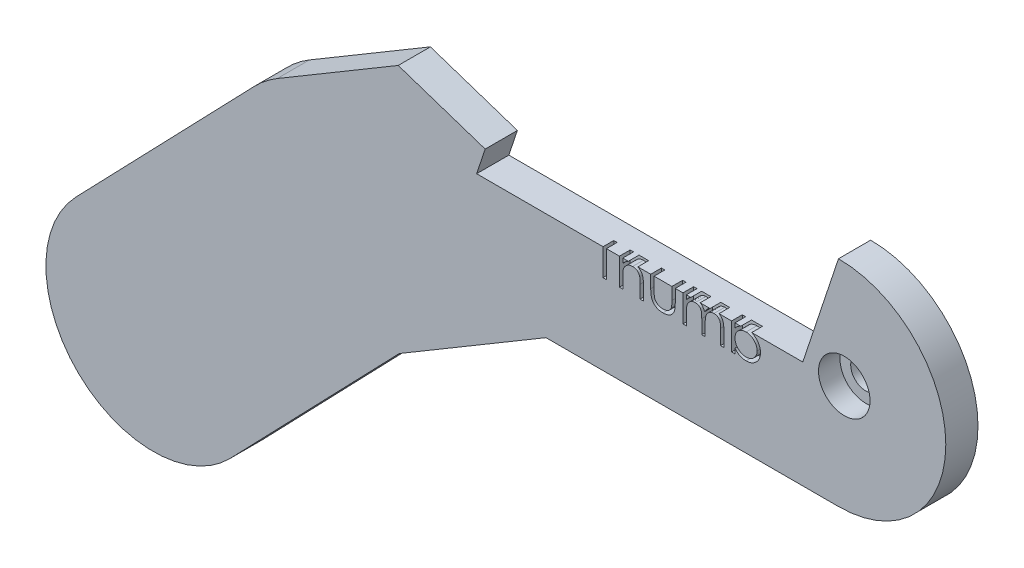
from build123d import *

# Parameters (mm, degrees)
BOSS_EXTRUDE1_DEPTH      = 3
BOSS_EXTRUDE2_DEPTH      = 3
BOSS_EXTRUDE4_DEPTH      = 3
SKETCH4_R                = 1.4
CUT_EXTRUDE5_DEPTH       = 3
SKETCH5_R                = 2.4
CUT_EXTRUDE6_DEPTH       = 2
CUT_EXTRUDE7_DEPTH       = 1
CUT_EXTRUDE12_DEPTH      = 58.771647766
CUT_EXTRUDE12_DEPTH_BACK = 58.771647766
CUT_EXTRUDE14_DEPTH      = 10


with BuildPart() as part:
    # Sketch1 → Boss-Extrude1 (new body)
    with BuildSketch(Plane.XY):
        with BuildLine():
            Line((0, 10), (30, 10))
            ThreePointArc((30, 10), (40, 0), (30, -10))
            Line((30, -10), (0, -10))
            ThreePointArc((0, -10), (-10, 0), (0, 10))
        make_face()
    extrude(amount=BOSS_EXTRUDE1_DEPTH)

    # Sketch2 → Boss-Extrude2 (add)
    with BuildSketch(Plane.XY):
        with BuildLine():
            Line((5.104260767, -8.599216361), (-12.094171954, -18.807737895))
            ThreePointArc((-12.094171954, -18.807737895), (-25.797649082, -15.312782302), (-22.302693489, -1.609305174))
            Line((-22.302693489, -1.609305174), (-5.104260767, 8.599216361))
            ThreePointArc((-5.104260767, 8.599216361), (8.599216361, 5.104260767), (5.104260767, -8.599216361))
        make_face()
    extrude(amount=BOSS_EXTRUDE2_DEPTH)

    # Sketch3 → Boss-Extrude4 (add)
    with BuildSketch(Plane.XY):
        with BuildLine():
            Line((-9.998884105, -17.148730445), (-26.65538549, -34.427647124))
            ThreePointArc((-26.65538549, -34.427647124), (-40.795143017, -34.68698683), (-41.054482723, -20.547229303))
            Line((-41.054482723, -20.547229303), (-24.397981338, -3.268312624))
            ThreePointArc((-24.397981338, -3.268312624), (-10.258223811, -3.008972918), (-9.998884105, -17.148730445))
        make_face()
    extrude(amount=BOSS_EXTRUDE4_DEPTH)

    # Sketch4 → Cut-Extrude5 (cut)
    with BuildSketch(Plane.XY):
        with Locations((30.538598823, 0)):
            Circle(SKETCH4_R)
    extrude(amount=CUT_EXTRUDE5_DEPTH, mode=Mode.SUBTRACT)

    # Sketch5 → Cut-Extrude6 (cut)
    with BuildSketch(Plane.XY.offset(3)):
        with Locations((30.538598823, 0)):
            Circle(SKETCH5_R)
    extrude(amount=-CUT_EXTRUDE6_DEPTH, mode=Mode.SUBTRACT)

    # Sketch6 → Cut-Extrude7 (cut)
    # profile 1 of 5: a face of its own
    with BuildSketch(Plane.XY.offset(3)):
        Polygon((7.297191398, 0.636947758), (7.297191398, 0.995922117), (9.136934988, 0.995922117), (9.136934988, 0.636947758), (8.374114475, 0.636947758), (8.374114475, -2.504077883), (8.060011911, -2.504077883), (8.060011911, 0.636947758), align=None)
    # profile 2 of 5: a face of its own
    with BuildSketch(Plane.XY.offset(3)):
        with BuildLine():
            Line((9.585652937, 1.085665707), (9.899755501, 1.085665707))
            Line((9.899755501, 1.085665707), (9.899755501, -0.429458492))
            add(Edge.make_bspline(
                [(9.899755501, -0.429458492), (9.933472803, -0.38731451), (9.999122117, -0.305258017), (10.109618233, -0.198196826), (10.223089105, -0.105398205), (10.343453915, -0.031527748), (10.468504436, 0.026828795), (10.59876808, 0.068216442), (10.734269051, 0.093667538), (10.826294201, 0.096865956), (10.872912552, 0.098486219)],
                knots=[0, 0, 0, 0, 1.125788106, 2.19196713, 3.20547328, 4.180437432, 5.132270164, 6.079753143, 7.027236121, 8, 8, 8, 8], degree=3))
            add(Edge.make_bspline(
                [(10.872912552, 0.098486219), (10.920242945, 0.096740789), (11.012879941, 0.093324561), (11.147761403, 0.06631118), (11.273722278, 0.020153742), (11.390388121, -0.043013283), (11.495212818, -0.12168611), (11.588062582, -0.212517633), (11.663903381, -0.317791551), (11.715502498, -0.415047805), (11.749075906, -0.501586559), (11.770327732, -0.575823071), (11.788346931, -0.658544984), (11.804046666, -0.749709717), (11.814510248, -0.849754888), (11.822914866, -0.958229143), (11.82889132, -1.075126261), (11.829122925, -1.15604651), (11.82924268, -1.197887979)],
                knots=[0, 0, 0, 0, 1.235656852, 2.418478516, 3.575258207, 4.727955599, 5.870717718, 6.98870536, 8.107142894, 9.245821548, 9.854588956, 10.528768408, 11.260415777, 12.065282286, 12.943670737, 13.886611085, 14.907229059, 16, 16, 16, 16], degree=3))
            Line((11.82924268, -1.197887979), (11.82924268, -2.504077883))
            Line((11.82924268, -2.504077883), (11.515140116, -2.504077883))
            Line((11.515140116, -2.504077883), (11.515140116, -1.300952883))
            add(Edge.make_bspline(
                [(11.515140116, -1.300952883), (11.514949813, -1.266130214), (11.514585796, -1.199520373), (11.513382451, -1.104154265), (11.510696236, -1.01765813), (11.50635541, -0.940309178), (11.501790103, -0.871999575), (11.495506785, -0.812828521), (11.488196551, -0.762714745), (11.48162777, -0.732550117), (11.478681783, -0.719021793)],
                knots=[0, 0, 0, 0, 1.430932559, 2.737130458, 3.918967929, 4.986496826, 5.920444988, 6.731744033, 7.431208747, 8, 8, 8, 8], degree=3))
            add(Edge.make_bspline(
                [(11.478681783, -0.719021793), (11.467257538, -0.67932753), (11.445294493, -0.603015539), (11.394246516, -0.499353129), (11.330487505, -0.410968388), (11.252640243, -0.3390541), (11.162081879, -0.282642561), (11.058221915, -0.243574779), (10.942037847, -0.219327057), (10.860186375, -0.216887753), (10.81752393, -0.215616345)],
                knots=[0, 0, 0, 0, 1.090059168, 2.095632401, 3.037101401, 3.955032261, 4.878929692, 5.839099886, 6.873700383, 8, 8, 8, 8], degree=3))
            add(Edge.make_bspline(
                [(10.81752393, -0.215616345), (10.792256157, -0.216092171), (10.742251887, -0.217033819), (10.668103221, -0.226487718), (10.596174158, -0.241936436), (10.52577198, -0.262840975), (10.458388782, -0.291286511), (10.392060457, -0.324216701), (10.328666248, -0.364524956), (10.267080431, -0.409750723), (10.209762898, -0.459820483), (10.156435783, -0.512667438), (10.108897442, -0.568942402), (10.065828851, -0.627742518), (10.028650566, -0.689874312), (9.996197484, -0.75473863), (9.968661787, -0.822420776), (9.954979095, -0.869395837), (9.948132905, -0.892899999)],
                knots=[0, 0, 0, 0, 1.024319606, 2.027102035, 3.025350316, 4.005802111, 5.00026367, 5.987881639, 7.005602596, 8.042517216, 9.083927026, 10.089214625, 11.084353441, 12.06828073, 13.041928858, 14.016821737, 15.00770877, 16, 16, 16, 16], degree=3))
            add(Edge.make_bspline(
                [(9.948132905, -0.892899999), (9.944193478, -0.909920949), (9.935608981, -0.947011696), (9.926294147, -1.00818602), (9.917956351, -1.079272392), (9.910907801, -1.160162993), (9.906584715, -1.251154235), (9.901926474, -1.351625194), (9.90019246, -1.462205215), (9.899905507, -1.539100722), (9.899755501, -1.579298236)],
                knots=[0, 0, 0, 0, 0.607992626, 1.324890765, 2.152360218, 3.099583803, 4.150613268, 5.323148443, 6.60066238, 8, 8, 8, 8], degree=3))
            Line((9.899755501, -1.579298236), (9.899755501, -2.504077883))
            Line((9.899755501, -2.504077883), (9.585652937, -2.504077883))
            Line((9.585652937, -2.504077883), (9.585652937, 1.085665707))
        make_face()
    # profile 3 of 5: a face of its own
    with BuildSketch(Plane.XY.offset(3)):
        with BuildLine():
            Line((12.502319604, 0.053614425), (12.816422168, 0.053614425))
            Line((12.816422168, 0.053614425), (12.816422168, -1.132683652))
            add(Edge.make_bspline(
                [(12.816422168, -1.132683652), (12.816564073, -1.167506402), (12.81683553, -1.23412069), (12.818676471, -1.329975876), (12.823006565, -1.417392589), (12.828420389, -1.496421326), (12.835382525, -1.567048717), (12.843665886, -1.629028074), (12.852924307, -1.683062258), (12.861987021, -1.715605614), (12.866201815, -1.730740543)],
                knots=[0, 0, 0, 0, 1.388932606, 2.656963016, 3.823490214, 4.879454478, 5.816252168, 6.653371382, 7.373723809, 8, 8, 8, 8], degree=3))
            add(Edge.make_bspline(
                [(12.866201815, -1.730740543), (12.87296327, -1.749763414), (12.886345611, -1.787413675), (12.910619095, -1.841802681), (12.940647431, -1.892177963), (12.973507259, -1.940482036), (13.011406667, -1.985284023), (13.053866138, -2.026508266), (13.099464375, -2.065712358), (13.167219398, -2.11209715), (13.259878664, -2.16181248), (13.38153142, -2.204708298), (13.513435646, -2.230344118), (13.604600365, -2.233318373), (13.651458225, -2.234847114)],
                knots=[0, 0, 0, 0, 0.725840625, 1.436591201, 2.137033971, 2.831655856, 3.53531722, 4.242432219, 4.957935707, 5.694543706, 7.190802206, 8.724350549, 10.316345118, 12, 12, 12, 12], degree=3))
            add(Edge.make_bspline(
                [(13.651458225, -2.234847114), (13.698311733, -2.233285865), (13.788964601, -2.230265138), (13.919419571, -2.2054816), (14.038670985, -2.16407591), (14.145521936, -2.106268499), (14.239487777, -2.035526436), (14.317792195, -1.952517627), (14.38239945, -1.85986824), (14.41060887, -1.790743961), (14.424795565, -1.755980928)],
                knots=[0, 0, 0, 0, 1.157059328, 2.238695713, 3.266970494, 4.264342957, 5.228770407, 6.160125903, 7.074715775, 8, 8, 8, 8], degree=3))
            add(Edge.make_bspline(
                [(14.424795565, -1.755980928), (14.428989795, -1.742014629), (14.438262213, -1.711138554), (14.448224565, -1.658758806), (14.457199027, -1.596294201), (14.464862203, -1.523335992), (14.470327365, -1.44007484), (14.473273392, -1.346536764), (14.476601667, -1.243015404), (14.476652183, -1.170547644), (14.476678578, -1.132683652)],
                knots=[0, 0, 0, 0, 0.557542046, 1.232589297, 2.036731608, 2.971723315, 4.038036528, 5.22795436, 6.551621927, 8, 8, 8, 8], degree=3))
            Line((14.476678578, -1.132683652), (14.476678578, 0.053614425))
            Line((14.476678578, 0.053614425), (14.790781142, 0.053614425))
            Line((14.790781142, 0.053614425), (14.790781142, -1.191577883))
            add(Edge.make_bspline(
                [(14.790781142, -1.191577883), (14.790339447, -1.233885055), (14.789482499, -1.315966754), (14.783975155, -1.435250866), (14.774525543, -1.546413111), (14.760182858, -1.649512331), (14.743317183, -1.744469812), (14.72156091, -1.831407258), (14.695582672, -1.910056812), (14.666277157, -1.981798589), (14.63165529, -2.046845483), (14.594828269, -2.1085813), (14.552303498, -2.165474235), (14.507533263, -2.220356372), (14.457731607, -2.2704979), (14.403831748, -2.317049376), (14.346592329, -2.360722407), (14.284743131, -2.399813687), (14.219187068, -2.435030332), (14.149843211, -2.46624641), (14.075862212, -2.490948987), (13.998198575, -2.512259653), (13.916471796, -2.528974122), (13.830760663, -2.540760689), (13.741094047, -2.54798602), (13.679984587, -2.548623065), (13.648653738, -2.548949678)],
                knots=[0, 0, 0, 0, 1.493040784, 2.896703357, 4.213163133, 5.428574705, 6.569057535, 7.615249723, 8.588095153, 9.490268104, 10.346124644, 11.18633936, 12.024365274, 12.850166724, 13.684164916, 14.514361689, 15.362232829, 16.222528818, 17.093394965, 17.986930858, 18.902426812, 19.842810585, 20.827885679, 21.843828298, 22.894529745, 24, 24, 24, 24], degree=3))
            add(Edge.make_bspline(
                [(13.648653738, -2.548949678), (13.617557224, -2.548609971), (13.556449679, -2.547942415), (13.466778435, -2.540800607), (13.380829828, -2.528992436), (13.29890943, -2.512137219), (13.220935033, -2.491098149), (13.146590793, -2.466094614), (13.07674723, -2.435014132), (13.010565226, -2.400036574), (12.948562838, -2.360471299), (12.890454259, -2.317103259), (12.836317407, -2.269997196), (12.786140339, -2.219349839), (12.740627362, -2.164532903), (12.699211321, -2.105987342), (12.661254615, -2.044293254), (12.626901825, -1.978230091), (12.59739007, -1.905658082), (12.571334824, -1.825360984), (12.550024185, -1.736458468), (12.532681717, -1.639026539), (12.518730276, -1.533531498), (12.509044134, -1.419363082), (12.503628303, -1.29679939), (12.502765242, -1.2121495), (12.502319604, -1.168440864)],
                knots=[0, 0, 0, 0, 1.083640291, 2.129454052, 3.13281866, 4.105697902, 5.042300162, 5.946461698, 6.836384745, 7.703652036, 8.553297018, 9.397182691, 10.228592656, 11.052265423, 11.879314572, 12.708807002, 13.549817954, 14.402308542, 15.300838682, 16.27712199, 17.341985831, 18.484375296, 19.725102775, 21.0496083, 22.476576903, 24, 24, 24, 24], degree=3))
            Line((12.502319604, -1.168440864), (12.502319604, 0.053614425))
        make_face()
    # profile 4 of 5: a face of its own
    with BuildSketch(Plane.XY.offset(3)):
        with BuildLine():
            Line((15.50872986, 0.053614425), (15.822832424, 0.053614425))
            Line((15.822832424, 0.053614425), (15.822832424, -0.390896793))
            add(Edge.make_bspline(
                [(15.822832424, -0.390896793), (15.851116374, -0.352009192), (15.905311134, -0.277496819), (15.994176786, -0.179306534), (16.082952899, -0.09597838), (16.14688628, -0.052235508), (16.177600052, -0.031221313)],
                knots=[0, 0, 0, 0, 1.134379233, 2.173579362, 3.122582517, 4, 4, 4, 4], degree=3))
            add(Edge.make_bspline(
                [(16.177600052, -0.031221313), (16.219464714, -0.011215947), (16.302462614, 0.028445266), (16.433881839, 0.068678825), (16.568356509, 0.093403926), (16.659164723, 0.0967853), (16.704843642, 0.098486219)],
                knots=[0, 0, 0, 0, 1.014936303, 2.012140481, 3.000054389, 4, 4, 4, 4], degree=3))
            add(Edge.make_bspline(
                [(16.704843642, 0.098486219), (16.735736639, 0.097440929), (16.796872218, 0.095372354), (16.887456308, 0.081912319), (16.97531492, 0.058646146), (17.059928949, 0.026238822), (17.139649628, -0.013007865), (17.212738826, -0.059057573), (17.278363034, -0.110754648), (17.336489085, -0.170433581), (17.388758111, -0.239770179), (17.436836957, -0.320634428), (17.48126217, -0.414842089), (17.505883479, -0.48320863), (17.518846046, -0.519202082)],
                knots=[0, 0, 0, 0, 1.009824226, 1.998387844, 2.986035974, 3.974953746, 4.955485308, 5.885931332, 6.793869504, 7.679848016, 8.601185859, 9.625726857, 10.749998409, 12, 12, 12, 12], degree=3))
            add(Edge.make_bspline(
                [(17.518846046, -0.519202082), (17.532557297, -0.494477663), (17.559539114, -0.445823478), (17.604844751, -0.376965215), (17.652312548, -0.312558424), (17.702347041, -0.252551999), (17.754771628, -0.197242269), (17.809833028, -0.146446367), (17.86721781, -0.099946153), (17.947010049, -0.045622994), (18.050822657, 0.012078187), (18.181710772, 0.062106631), (18.317860943, 0.09302276), (18.410278641, 0.096653033), (18.456947007, 0.098486219)],
                knots=[0, 0, 0, 0, 0.86119277, 1.694706429, 2.50939023, 3.298075842, 4.073795165, 4.829715201, 5.57930267, 6.321991688, 7.768977793, 9.186738141, 10.579381044, 12, 12, 12, 12], degree=3))
            add(Edge.make_bspline(
                [(18.456947007, 0.098486219), (18.49982847, 0.096868999), (18.583751656, 0.09370394), (18.705928922, 0.068850467), (18.819870728, 0.02617282), (18.925347804, -0.032060817), (19.020507617, -0.10524), (19.103223926, -0.192308838), (19.17299429, -0.292651461), (19.218572929, -0.387043449), (19.249488193, -0.470378782), (19.268549428, -0.541385073), (19.285389123, -0.619536626), (19.299370368, -0.704926888), (19.30958892, -0.797857496), (19.317159636, -0.898176372), (19.322283709, -1.005961484), (19.322645782, -1.080326984), (19.322832424, -1.118661216)],
                knots=[0, 0, 0, 0, 1.209669288, 2.367440248, 3.500751976, 4.631527125, 5.755587489, 6.87532382, 8.007944318, 9.190864318, 9.82315674, 10.514484317, 11.263564316, 12.079023757, 12.955305781, 13.901327259, 14.918167583, 16, 16, 16, 16], degree=3))
            Line((19.322832424, -1.118661216), (19.322832424, -2.504077883))
            Line((19.322832424, -2.504077883), (19.00872986, -2.504077883))
            Line((19.00872986, -2.504077883), (19.00872986, -1.117258973))
            add(Edge.make_bspline(
                [(19.00872986, -1.117258973), (19.008651977, -1.084538399), (19.008502298, -1.021654432), (19.005808666, -0.931401981), (19.000733352, -0.849133624), (18.994798713, -0.774961535), (18.986554904, -0.708712747), (18.975908972, -0.650520328), (18.964631292, -0.599926517), (18.945895301, -0.543840469), (18.91594741, -0.481970259), (18.87032993, -0.415246683), (18.812859823, -0.357165883), (18.746499667, -0.306747566), (18.670951222, -0.265753925), (18.587686499, -0.236477915), (18.497222447, -0.218355037), (18.434599659, -0.216549021), (18.402259507, -0.215616345)],
                knots=[0, 0, 0, 0, 1.253487763, 2.409012846, 3.458416907, 4.410876679, 5.259312806, 6.014470957, 6.676830364, 7.243083969, 8.276244668, 9.299465089, 10.325150304, 11.392391894, 12.482080715, 13.603491619, 14.762376348, 16, 16, 16, 16], degree=3))
            add(Edge.make_bspline(
                [(18.402259507, -0.215616345), (18.362589553, -0.217032502), (18.284186642, -0.219831367), (18.169741156, -0.24840524), (18.059770139, -0.291485491), (17.957555006, -0.353917948), (17.863527215, -0.428726312), (17.782627638, -0.517675908), (17.715795452, -0.618305835), (17.670541476, -0.711452537), (17.641952175, -0.795121981), (17.623075259, -0.868219353), (17.608391868, -0.951300921), (17.594621338, -1.043808412), (17.58563361, -1.146378592), (17.577465238, -1.258536993), (17.573644375, -1.380620952), (17.573109917, -1.465247641), (17.572832424, -1.509186056)],
                knots=[0, 0, 0, 0, 1.090531906, 2.155305635, 3.229839962, 4.33261226, 5.44038871, 6.529323825, 7.629011124, 8.757537029, 9.370236727, 10.061839251, 10.834451254, 11.692844982, 12.636905849, 13.66920014, 14.789842145, 16, 16, 16, 16], degree=3))
            Line((17.572832424, -1.509186056), (17.572832424, -2.504077883))
            Line((17.572832424, -2.504077883), (17.25872986, -2.504077883))
            Line((17.25872986, -2.504077883), (17.25872986, -1.203496954))
            add(Edge.make_bspline(
                [(17.25872986, -1.203496954), (17.258650429, -1.166803635), (17.258497612, -1.096209378), (17.255821294, -0.994975702), (17.250734673, -0.902894622), (17.244854124, -0.820073158), (17.236393946, -0.74666183), (17.226784184, -0.682267072), (17.215435573, -0.627050321), (17.196645689, -0.566486936), (17.16793122, -0.499766013), (17.121742958, -0.428624992), (17.064135378, -0.366356894), (16.996564502, -0.313198146), (16.92055882, -0.269256664), (16.836575419, -0.237596913), (16.745370506, -0.219172623), (16.6824928, -0.216824126), (16.650156142, -0.215616345)],
                knots=[0, 0, 0, 0, 1.320475261, 2.540461679, 3.643808994, 4.639130445, 5.527981419, 6.302341397, 6.981980563, 7.553956391, 8.582137848, 9.585246428, 10.591171744, 11.620968678, 12.668337649, 13.738356861, 14.836885341, 16, 16, 16, 16], degree=3))
            add(Edge.make_bspline(
                [(16.650156142, -0.215616345), (16.612139931, -0.217146805), (16.536374971, -0.220196957), (16.425073001, -0.247651231), (16.317587318, -0.290655306), (16.215632619, -0.350315125), (16.121958471, -0.424214203), (16.039950203, -0.511129099), (15.971007678, -0.609978133), (15.925275863, -0.702142649), (15.895777389, -0.783715924), (15.876182054, -0.853066872), (15.859342428, -0.93006712), (15.846828407, -1.014954231), (15.834747991, -1.107175325), (15.828917682, -1.207189815), (15.82324612, -1.314911903), (15.822973705, -1.389284448), (15.822832424, -1.427855928)],
                knots=[0, 0, 0, 0, 1.098833095, 2.189935336, 3.297829714, 4.440610912, 5.596351641, 6.740013378, 7.886572111, 9.072425424, 9.705826452, 10.395263256, 11.156850408, 11.985370555, 12.878090359, 13.847760091, 14.883794034, 16, 16, 16, 16], degree=3))
            Line((15.822832424, -1.427855928), (15.822832424, -2.504077883))
            Line((15.822832424, -2.504077883), (15.50872986, -2.504077883))
            Line((15.50872986, -2.504077883), (15.50872986, 0.053614425))
        make_face()
    # profile 5 of 5: a face of its own
    with BuildSketch(Plane.XY.offset(3)):
        with BuildLine():
            Line((20.040781142, -2.504077883), (20.040781142, 1.085665707))
            Line((20.040781142, 1.085665707), (20.354883706, 1.085665707))
            Line((20.354883706, 1.085665707), (20.354883706, -0.410528204))
            add(Edge.make_bspline(
                [(20.354883706, -0.410528204), (20.390277125, -0.369770272), (20.459331145, -0.290249867), (20.575107596, -0.186402217), (20.696513165, -0.098349739), (20.824471421, -0.025763621), (20.959164354, 0.029509986), (21.099896463, 0.069932376), (21.247027504, 0.094319279), (21.347346678, 0.097085352), (21.398152937, 0.098486219)],
                knots=[0, 0, 0, 0, 1.077089805, 2.101446609, 3.097517232, 4.067117542, 5.031729543, 5.997785507, 6.985986182, 8, 8, 8, 8], degree=3))
            add(Edge.make_bspline(
                [(21.398152937, 0.098486219), (21.443319075, 0.097245991), (21.532620227, 0.094793849), (21.663902374, 0.076159353), (21.790215649, 0.045941551), (21.911491297, 0.004049372), (22.027163429, -0.051533605), (22.138222486, -0.118074913), (22.244099471, -0.197313242), (22.343154356, -0.287911553), (22.434448243, -0.386268176), (22.514360753, -0.491448491), (22.581860449, -0.601923581), (22.637691741, -0.717323644), (22.680862794, -0.838119995), (22.710605062, -0.964194193), (22.729498526, -1.095422212), (22.731878772, -1.184735016), (22.733088834, -1.230139582)],
                knots=[0, 0, 0, 0, 1.034377878, 2.045141349, 3.03070803, 4.00595497, 4.978199603, 5.965204761, 6.967410914, 8.002051993, 9.036360596, 10.037508045, 11.022711142, 11.997267194, 12.969246472, 13.954813154, 14.960274251, 16, 16, 16, 16], degree=3))
            add(Edge.make_bspline(
                [(22.733088834, -1.230139582), (22.731852394, -1.2748396), (22.729414328, -1.362980995), (22.71079302, -1.492687551), (22.680046755, -1.61752625), (22.636085572, -1.737174508), (22.580820633, -1.852194421), (22.511709357, -1.961274825), (22.431898358, -2.066313801), (22.339567209, -2.163937432), (22.239653656, -2.254170832), (22.132739414, -2.332576697), (22.021517492, -2.400293817), (21.90425438, -2.453949265), (21.782686338, -2.497350186), (21.655510951, -2.527467877), (21.523447723, -2.545040932), (21.433728835, -2.547636499), (21.388337232, -2.548949678)],
                knots=[0, 0, 0, 0, 1.024244038, 2.01964794, 2.996620209, 3.965911562, 4.936179293, 5.91563013, 6.920572822, 7.955171681, 8.990768464, 10.002129126, 10.989675881, 11.969873457, 12.952483066, 13.943799762, 14.959703725, 16, 16, 16, 16], degree=3))
            add(Edge.make_bspline(
                [(21.388337232, -2.548949678), (21.336372119, -2.54750907), (21.234477595, -2.544684288), (21.08542493, -2.521265309), (20.94434338, -2.481403699), (20.809625832, -2.427841943), (20.683198109, -2.355313289), (20.564257527, -2.265356539), (20.453554154, -2.156489402), (20.388337339, -2.073427912), (20.354883706, -2.030820672)],
                knots=[0, 0, 0, 0, 1.035807596, 2.031038093, 2.998900396, 3.954262848, 4.914341711, 5.895762244, 6.92060972, 8, 8, 8, 8], degree=3))
            Line((20.354883706, -2.030820672), (20.354883706, -2.504077883))
            Line((20.354883706, -2.504077883), (20.040781142, -2.504077883))
        make_face()
        with BuildLine():
            add(Edge.make_bspline(
                [(21.385532745, -2.234847114), (21.431447097, -2.233213485), (21.522074726, -2.229988961), (21.655118516, -2.204815338), (21.782432726, -2.162931224), (21.903375808, -2.105647516), (22.01605512, -2.033625481), (22.116707754, -1.946479311), (22.206187464, -1.846977796), (22.28083924, -1.734744103), (22.343165484, -1.615293134), (22.38597876, -1.489638832), (22.414698482, -1.361144043), (22.41755078, -1.273997999), (22.41898627, -1.230139582)],
                knots=[0, 0, 0, 0, 1.031910345, 2.036826888, 3.032245421, 4.038315463, 5.03827337, 6.029480047, 7.023177075, 8.037597977, 9.052889626, 10.043399556, 11.015292101, 12, 12, 12, 12], degree=3))
            add(Edge.make_bspline(
                [(22.41898627, -1.230139582), (22.417098526, -1.18632404), (22.413330575, -1.098867879), (22.386955792, -0.969218212), (22.340898002, -0.843630587), (22.279779979, -0.722452599), (22.203911994, -0.609444798), (22.11490603, -0.507954671), (22.013024224, -0.420394687), (21.900200805, -0.347404616), (21.780020614, -0.287845063), (21.653529981, -0.247000037), (21.523371858, -0.22026185), (21.434976365, -0.217172722), (21.390440597, -0.215616345)],
                knots=[0, 0, 0, 0, 0.984795267, 1.965658976, 2.959410029, 3.983795688, 5.009594896, 6.01088574, 7.009236619, 8.019050059, 9.024672985, 10.014834719, 10.999826153, 12, 12, 12, 12], degree=3))
            add(Edge.make_bspline(
                [(21.390440597, -0.215616345), (21.34497309, -0.217171842), (21.254729313, -0.220259189), (21.121561091, -0.247047013), (20.991497807, -0.288094624), (20.867210275, -0.347025974), (20.75135622, -0.419137434), (20.647743608, -0.503877634), (20.55841205, -0.600657542), (20.484868279, -0.709163344), (20.42646348, -0.826348379), (20.384679732, -0.951360582), (20.359680086, -1.083541895), (20.356501953, -1.1741751), (20.354883706, -1.220323877)],
                knots=[0, 0, 0, 0, 1.016820015, 2.018181405, 3.029022337, 4.06341356, 5.088169224, 6.076823655, 7.05054209, 8.02560866, 9.001194327, 9.972267242, 10.967515442, 12, 12, 12, 12], degree=3))
            add(Edge.make_bspline(
                [(20.354883706, -1.220323877), (20.355843377, -1.255661695), (20.357732312, -1.325217705), (20.37216268, -1.427345395), (20.395118342, -1.525078488), (20.427461836, -1.618523483), (20.469963071, -1.707149923), (20.521173336, -1.791646003), (20.582124983, -1.871249281), (20.651031572, -1.945764601), (20.726993953, -2.013574016), (20.808517072, -2.072352241), (20.893935002, -2.122966431), (20.984224973, -2.163311274), (21.078336264, -2.196237794), (21.177234605, -2.21797154), (21.279906029, -2.232946579), (21.349953126, -2.234206932), (21.385532745, -2.234847114)],
                knots=[0, 0, 0, 0, 1.050331198, 2.067384183, 3.060053655, 4.031335885, 5.001026174, 5.976994447, 6.963687968, 7.976578778, 8.990422448, 9.985569286, 10.960374351, 11.936812464, 12.921228065, 13.919088064, 14.943024695, 16, 16, 16, 16], degree=3))
        make_face(mode=Mode.SUBTRACT)
    extrude(amount=-CUT_EXTRUDE7_DEPTH, mode=Mode.SUBTRACT)

    # Sketch8 → Cut-Extrude12 (cut, two sides: drawn at the far end of the back side and taken through both)
    with BuildSketch(Plane.XY.offset(3).offset(-CUT_EXTRUDE12_DEPTH_BACK)):
        Polygon((30, 10), (26.672395473, 0), (-3.717396591, 0), (-0.389792064, 10), align=None)
    extrude(amount=CUT_EXTRUDE12_DEPTH + CUT_EXTRUDE12_DEPTH_BACK, mode=Mode.SUBTRACT)

    # Sketch12 → Cut-Extrude14 (cut)
    with BuildSketch(Plane.XY.offset(3)):
        Polygon((-0.39235434, 9.992299939), (-2.922803581, 2.387882947), (-11.025921067, 5.08427999), (-6.240128993, 7.924995899), (-5.104260767, 8.599216361), (-1.799910498, 10.560588739), align=None)
    extrude(amount=-CUT_EXTRUDE14_DEPTH, mode=Mode.SUBTRACT)


solid = part.part
